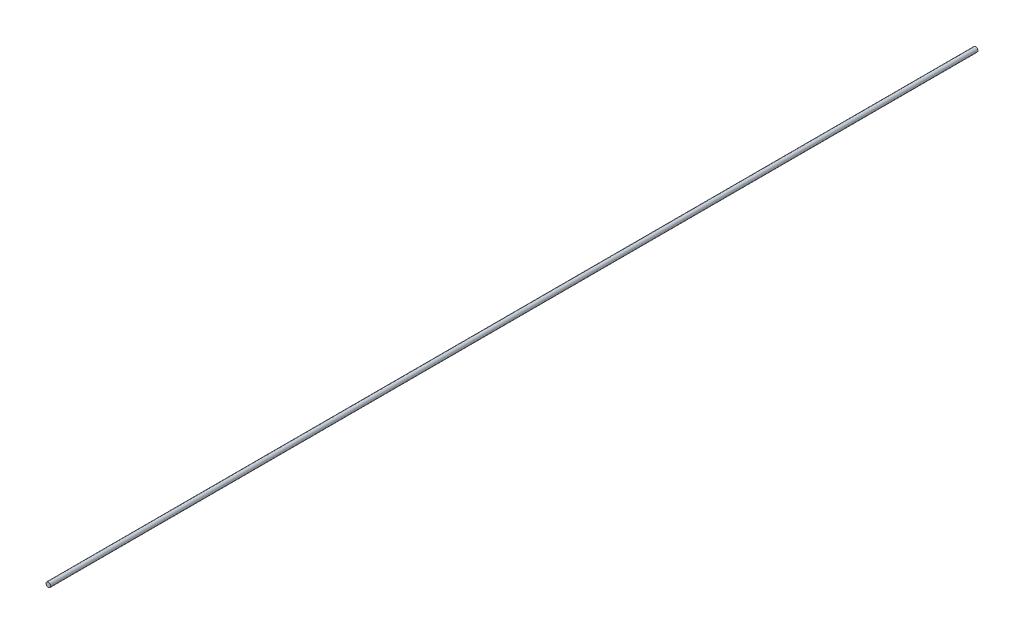
from build123d import *

# Parameters (mm, degrees)
SCHIZZO1_R                   = 1.5
ESTRUSIONE_ESTRUSIONE1_DEPTH = 600


with BuildPart() as part:
    # Schizzo1 → Estrusione-Estrusione1 (new body)
    with BuildSketch(Plane.XY):
        Circle(SCHIZZO1_R)
    extrude(amount=ESTRUSIONE_ESTRUSIONE1_DEPTH)


solid = part.part
